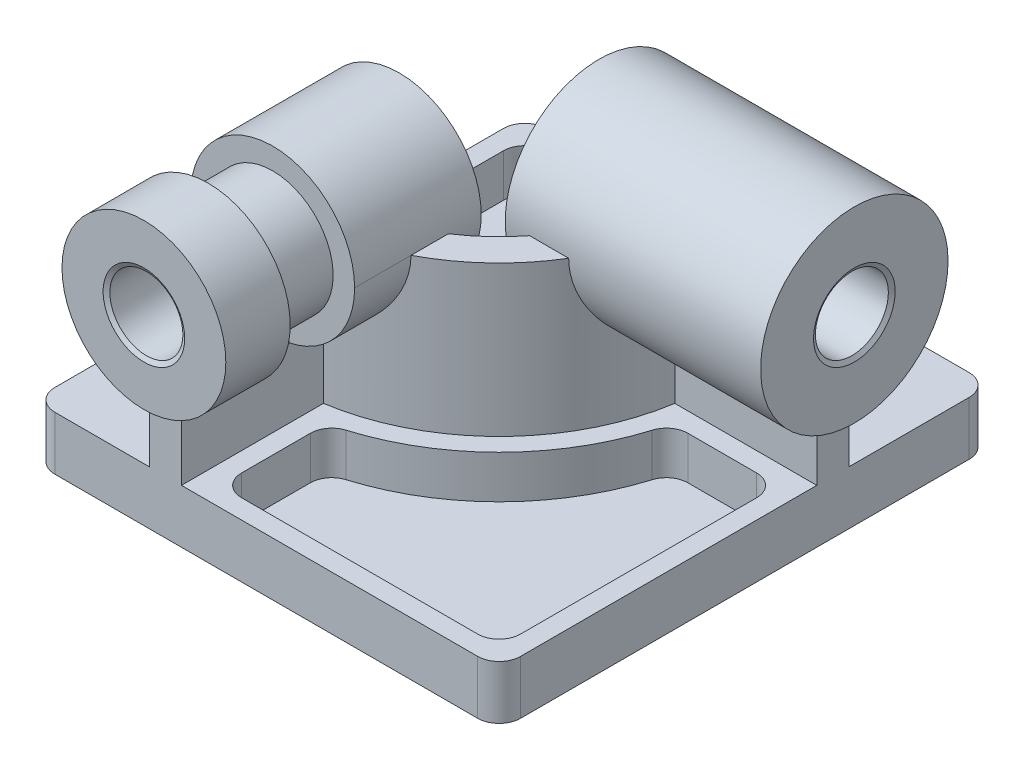
from build123d import *
from OCP.BRepFilletAPI import BRepFilletAPI_MakeChamfer

# Parameters (mm, degrees)
SKETCH1_W           = 217
SKETCH1_H           = 229
BOSS_EXTRUDE1_DEPTH = 25
BOSS_EXTRUDE2_DEPTH = 70
BOSS_EXTRUDE3_START = 10
SKETCH3_R           = 38.166666667
BOSS_EXTRUDE3_DEPTH = 119
SKETCH11_W          = 30
SKETCH11_H          = 10
BOSS_EXTRUDE6_DEPTH = 70
BOSS_EXTRUDE4_START = 10
SKETCH4_R           = 43.666666667
BOSS_EXTRUDE4_DEPTH = 119
SKETCH5_R           = 17
CUT_EXTRUDE1_DEPTH  = 318.311273787
SKETCH6_R           = 17
CUT_EXTRUDE2_DEPTH  = 327.003749222
CUT_EXTRUDE3_DEPTH  = 20
FILLET1_R           = 10
CHAMFER1_SIZE       = 2
CHAMFER1_SIZE2      = 1.154700538
CUT_EXTRUDE4_DEPTH  = 20


with BuildPart() as part:
    # Sketch1 → Boss-Extrude1 (new body)
    with BuildSketch(Plane(origin=(0, 0, 0), x_dir=(1, 0, 0), z_dir=(0, 1, 0))):
        with Locations((54.5, -48.5)):
            Rectangle(SKETCH1_W, SKETCH1_H)
    extrude(amount=BOSS_EXTRUDE1_DEPTH)

    # Sketch2 → Boss-Extrude2 (add)
    with BuildSketch(Plane(origin=(0, 25, 0), x_dir=(1, 0, 0), z_dir=(0, 1, 0))):
        with BuildLine():
            Line((0, -98), (0, -163))
            Line((0, -163), (15, -163))
            Line((15, -163), (15, -96.845237364))
            ThreePointArc((15, -96.845237364), (7.522191781, -97.710882868), (0, -98))
        make_face()
        with BuildLine():
            Line((0, -83), (0, -98))
            ThreePointArc((0, -98), (7.522191781, -97.710882868), (15, -96.845237364))
            Line((15, -96.845237364), (15, -83))
            Line((15, -83), (0, -83))
        make_face()
        with BuildLine():
            Line((15, -83), (15, -96.845237364))
            ThreePointArc((15, -96.845237364), (69.296464556, -69.296464556), (96.845237364, -15))
            Line((96.845237364, -15), (83, -15))
            Line((83, -15), (83, 0))
            ThreePointArc((83, 0), (58.689862838, -58.689862838), (0, -83))
            Line((0, -83), (15, -83))
        make_face()
        with BuildLine():
            Line((83, -15), (96.845237364, -15))
            ThreePointArc((96.845237364, -15), (97.710882868, -7.522191781), (98, 0))
            Line((98, 0), (83, 0))
            Line((83, 0), (83, -15))
        make_face()
        with BuildLine():
            ThreePointArc((98, 0), (97.710882868, -7.522191781), (96.845237364, -15))
            Line((96.845237364, -15), (163, -15))
            Line((163, -15), (163, 0))
            Line((163, 0), (98, 0))
        make_face()
    extrude(amount=BOSS_EXTRUDE2_DEPTH)

    # Sketch3 → Boss-Extrude3 (add)
    with BuildSketch(Plane.XY.offset(163).offset(BOSS_EXTRUDE3_START)):
        with Locations((7.5, 95)):
            Circle(SKETCH3_R)
    extrude(amount=-BOSS_EXTRUDE3_DEPTH)

    # Sketch11 → Cut-Revolve7 (revolve, cut)
    with BuildSketch(Plane.ZY.offset(-7.5), mode=Mode.PRIVATE) as cut_revolve7_sk:
        with Locations((128, 128.166666667)):
            Rectangle(SKETCH11_W, SKETCH11_H)
    revolve(cut_revolve7_sk.sketch.rotate(Axis((7.5, 95, 54), (0, 0, 1)), 270), axis=Axis((7.5, 95, 54), (0, 0, 1)), mode=Mode.SUBTRACT)

    # Sketch2<3> → Boss-Extrude6 (add)
    with BuildSketch(Plane(origin=(0, 25, 0), x_dir=(1, 0, 0), z_dir=(0, 1, 0))):
        with BuildLine():
            Line((0, -98), (0, -163))
            Line((0, -163), (15, -163))
            Line((15, -163), (15, -96.845237364))
            ThreePointArc((15, -96.845237364), (7.522191781, -97.710882868), (0, -98))
        make_face()
    extrude(amount=BOSS_EXTRUDE6_DEPTH)

    # Sketch4 → Boss-Extrude4 (add)
    with BuildSketch(Plane(origin=(163, 0, 0), x_dir=(0, 0, -1), z_dir=(1, 0, 0)).offset(BOSS_EXTRUDE4_START)):
        with Locations((-7.5, 95)):
            Circle(SKETCH4_R)
    extrude(amount=-BOSS_EXTRUDE4_DEPTH)

    # Sketch5 → Cut-Extrude1 (cut, through all)
    with BuildSketch(Plane(origin=(173, 0, 0), x_dir=(0, 0, -1), z_dir=(1, 0, 0))):
        with Locations((-7.5, 95)):
            Circle(SKETCH5_R)
    extrude(amount=-CUT_EXTRUDE1_DEPTH, mode=Mode.SUBTRACT)

    # Sketch6 → Cut-Extrude2 (cut, through all)
    with BuildSketch(Plane.XY.offset(173)):
        with Locations((7.5, 95)):
            Circle(SKETCH6_R)
    extrude(amount=-CUT_EXTRUDE2_DEPTH, mode=Mode.SUBTRACT)

    # Sketch8 → Cut-Extrude3 (cut)
    with BuildSketch(Plane(origin=(0, 25, 0), x_dir=(1, 0, 0), z_dir=(0, 1, 0))):
        with BuildLine():
            Line((24, -111.950882087), (24, -144))
            ThreePointArc((24, -144), (26.928932188, -151.071067812), (34, -154))
            Line((34, -154), (144, -154))
            ThreePointArc((144, -154), (151.071067812, -151.071067812), (154, -144))
            Line((154, -144), (154, -34))
            ThreePointArc((154, -34), (151.071067812, -26.928932188), (144, -24))
            Line((144, -24), (111.950882087, -24))
            ThreePointArc((111.950882087, -24), (105.995205343, -25.966948617), (102.382430626, -31.094017094))
            ThreePointArc((102.382430626, -31.094017094), (75.660425587, -75.660425587), (31.094017094, -102.382430626))
            ThreePointArc((31.094017094, -102.382430626), (25.966948617, -105.995205343), (24, -111.950882087))
        make_face()
    extrude(amount=-CUT_EXTRUDE3_DEPTH, mode=Mode.SUBTRACT)

    # Fillet1
    fillet1_edges = [part.edges().sort_by_distance(p)[0] for p in [
        (-54, 12.5, -66),
        (163, 12.5, -66),
        (163, 12.5, 163),
        (-54, 12.5, 163),
    ]]
    fillet(fillet1_edges, radius=FILLET1_R)

    # Chamfer1: one chamfer whose edges measure the first distance from different faces: ONE call of the kernel's chamfer builder (chamfer() names one face for all edges)
    chamfer1_edges_1 = [part.edges().sort_by_distance(p)[0] for p in [
        (54, 95, 24.5),
    ]]
    chamfer1_side_1 = [part.faces().sort_by_distance(p)[0] for p in [
        (113.5, 95, 24.5),
    ]]
    chamfer1_edges_2 = [part.edges().sort_by_distance(p)[0] for p in [
        (173, 95, 24.5),
    ]]
    chamfer1_side_2 = [part.faces().sort_by_distance(p)[0] for p in [
        (173, 95, 49.931586822),
    ]]
    chamfer1_edges_3 = [part.edges().sort_by_distance(p)[0] for p in [
        (-9.5, 95, 54),
    ]]
    chamfer1_side_3 = [part.faces().sort_by_distance(p)[0] for p in [
        (-9.5, 95, 113.5),
    ]]
    chamfer1_edges_4 = [part.edges().sort_by_distance(p)[0] for p in [
        (-9.5, 95, 173),
    ]]
    chamfer1_side_4 = [part.faces().sort_by_distance(p)[0] for p in [
        (-29.587150314, 95, 173),
    ]]
    chamfer1 = BRepFilletAPI_MakeChamfer(part.part.solid().wrapped)
    for e in chamfer1_edges_1:
        chamfer1.Add(CHAMFER1_SIZE, CHAMFER1_SIZE2, e.wrapped, chamfer1_side_1[0].wrapped)  # the first distance lies on this face
    for e in chamfer1_edges_2:
        chamfer1.Add(CHAMFER1_SIZE, CHAMFER1_SIZE2, e.wrapped, chamfer1_side_2[0].wrapped)  # the first distance lies on this face
    for e in chamfer1_edges_3:
        chamfer1.Add(CHAMFER1_SIZE, CHAMFER1_SIZE2, e.wrapped, chamfer1_side_3[0].wrapped)  # the first distance lies on this face
    for e in chamfer1_edges_4:
        chamfer1.Add(CHAMFER1_SIZE, CHAMFER1_SIZE2, e.wrapped, chamfer1_side_4[0].wrapped)  # the first distance lies on this face
    add(Compound.cast(chamfer1.Shape()), mode=Mode.REPLACE)

    # Sketch10 → Cut-Extrude4 (cut)
    with BuildSketch(Plane(origin=(0, 25, 0), x_dir=(1, 0, 0), z_dir=(0, 1, 0))):
        with BuildLine():
            Line((74, 0), (74, 47))
            ThreePointArc((74, 47), (71.071067812, 54.071067812), (64, 57))
            Line((64, 57), (-35, 57))
            ThreePointArc((-35, 57), (-42.071067812, 54.071067812), (-45, 47))
            Line((-45, 47), (-45, -64))
            ThreePointArc((-45, -64), (-42.071067812, -71.071067812), (-35, -74))
            Line((-35, -74), (0, -74))
            ThreePointArc((0, -74), (52.325901808, -52.325901808), (74, 0))
        make_face()
    extrude(amount=-CUT_EXTRUDE4_DEPTH, mode=Mode.SUBTRACT)


solid = part.part
